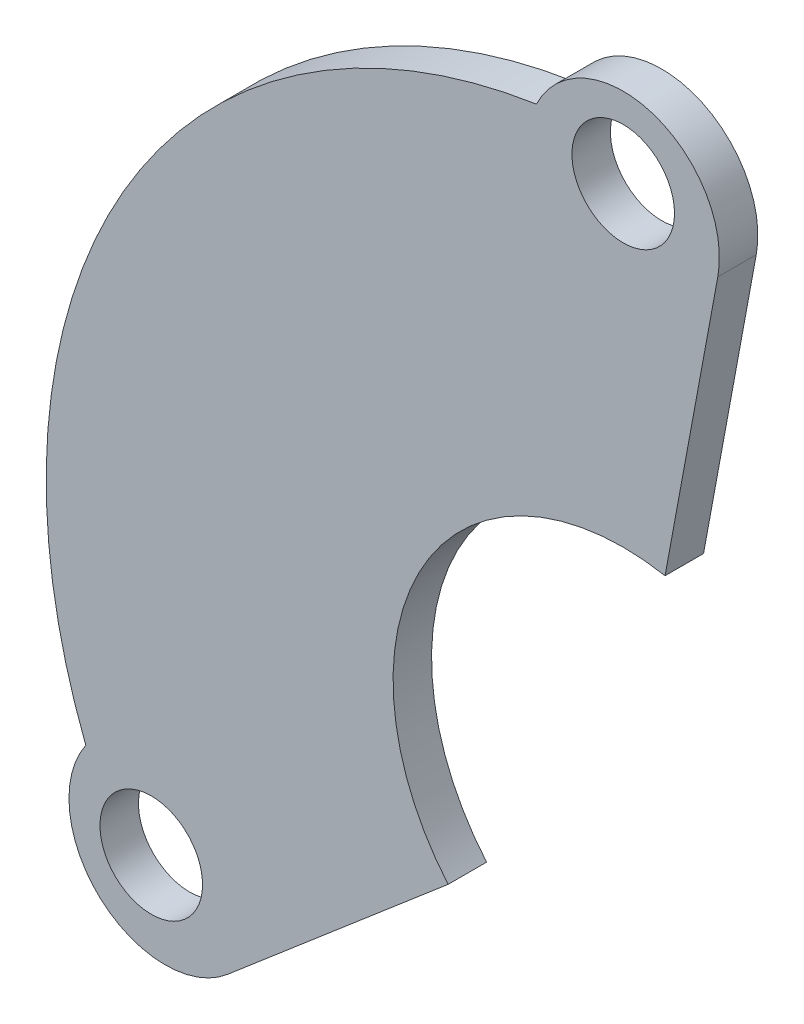
from build123d import *

# Parameters (mm, degrees)
SKETCH_1_R          = 7.18
EXTRUDE_1_DEPTH     = 1.2
SKETCH_2_R          = 1.6
CUT_EXTRUDE_1_DEPTH = 10
CUT_EXTRUDE_START   = -11.2
CUT_EXTRUDE_4_DEPTH = 11.2


with BuildPart() as part:
    # 草图1 → 凸台-拉伸1 (new body)
    with BuildSketch(Plane.XY):
        with BuildLine():
            ThreePointArc((-14.058374697, -11.241089844), (0, -18), (14.058374697, -11.241089844))
            ThreePointArc((14.058374697, -11.241089844), (16.887495374, -9.75), (16.76425672, -6.554364701))
            ThreePointArc((16.76425672, -6.554364701), (15.588457268, 9), (2.705882023, 17.795454545))
            ThreePointArc((2.705882023, 17.795454545), (0, 19.5), (-2.705882023, 17.795454545))
            ThreePointArc((-2.705882023, 17.795454545), (-15.588457268, 9), (-16.76425672, -6.554364701))
            ThreePointArc((-16.76425672, -6.554364701), (-16.887495374, -9.75), (-14.058374697, -11.241089844))
        make_face()
        Circle(SKETCH_1_R, mode=Mode.SUBTRACT)
    extrude(amount=EXTRUDE_1_DEPTH)

    # 草图2 → 切除-拉伸1 (cut)
    with BuildSketch(Plane.XY.offset(1.2)):
        with Locations((0, 17)):
            Circle(SKETCH_2_R)
        with Locations((14.722431864, -8.5)):
            Circle(SKETCH_2_R)
        with Locations((-14.722431864, -8.5)):
            Circle(SKETCH_2_R)
    extrude(amount=-CUT_EXTRUDE_1_DEPTH, mode=Mode.SUBTRACT)

    # 草图4 → 切除-拉伸4 (cut)
    with BuildSketch(Plane.XY.offset(11.2).offset(CUT_EXTRUDE_START)):
        with BuildLine():
            Line((0, 0), (2.949996498, 15.954545455))
            ThreePointArc((2.949996498, 15.954545455), (0.928512003, 19.352694421), (-2.705882023, 17.795454545))
            Line((-2.705882023, 17.795454545), (-0.609984312, 23.633101635))
            Line((-0.609984312, 23.633101635), (9.450831052, 25.36709559))
            Line((9.450831052, 25.36709559), (30.272136365, -16.841499514))
            Line((30.272136365, -16.841499514), (-5.709784057, -19.189026381))
            Line((-5.709784057, -19.189026381), (-25.420914817, -11.863123573))
            Line((-25.420914817, -11.863123573), (-16.76425672, -6.554364701))
            ThreePointArc((-16.76425672, -6.554364701), (-16.295668999, -10.480462193), (-12.34204342, -10.532044636))
            Line((-12.34204342, -10.532044636), (0, 0))
        make_face()
    extrude(amount=CUT_EXTRUDE_4_DEPTH, mode=Mode.SUBTRACT)


solid = part.part
